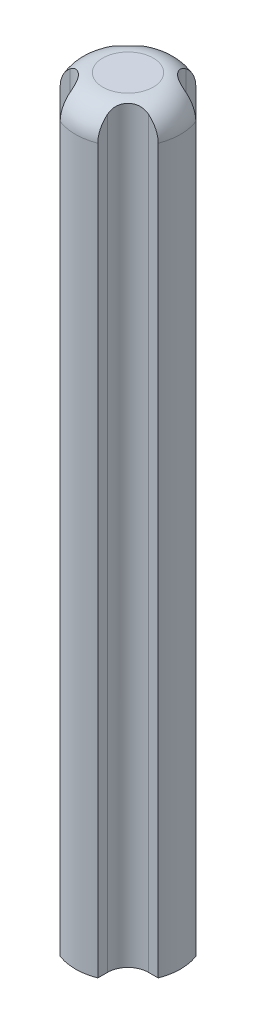
from build123d import *

# Parameters (mm, degrees)
SKETCH1_R           = 3.85
BOSS_EXTRUDE1_DEPTH = 55
FILLET1_R           = 2
SKETCH2_W           = 2.5
SKETCH2_H           = 2.5
CUT_EXTRUDE1_DEPTH  = 56.268842948
CIRPATTERN1_COUNT   = 4
FILLET2_R           = 1.5


with BuildPart() as part:
    # Sketch1 → Boss-Extrude1 (new body)
    with BuildSketch(Plane(origin=(0, 0, 0), x_dir=(1, 0, 0), z_dir=(0, 1, 0))):
        with Locations(Location((0, 0, 0), (0, 0, 270))):
            Circle(SKETCH1_R)
    extrude(amount=BOSS_EXTRUDE1_DEPTH)

    # Fillet1
    fillet1_edges = [part.edges().sort_by_distance(p)[0] for p in [
        (0, 55, -3.85),
    ]]
    fillet(fillet1_edges, radius=FILLET1_R)

    # Sketch2 → Cut-Extrude1 (cut, through all)
    with BuildSketch(Plane(origin=(0, 55, 0), x_dir=(1, 0, 0), z_dir=(0, 1, 0))):
        with Locations((2.628858223, -2.628858223)):
            Rectangle(SKETCH2_W, SKETCH2_H)
    cut_extrude1 = extrude(amount=-CUT_EXTRUDE1_DEPTH, mode=Mode.SUBTRACT)

    # CirPattern1: Cut-Extrude1 ×4 about axis
    cirpattern1_axis = Axis((0, 0, 0), (0, 1, 0))
    for i in range(1, CIRPATTERN1_COUNT):
        add(cut_extrude1.rotate(cirpattern1_axis, i * 360 / CIRPATTERN1_COUNT), mode=Mode.SUBTRACT)

    # Fillet2
    fillet2_edges = [part.edges().sort_by_distance(p)[0] for p in [
        (1.378858223, 27.498749218, -1.378858223),
        (-1.378858223, 27.498749218, -1.378858223),
        (-1.378858223, 27.498749218, 1.378858223),
        (1.378858223, 27.498749218, 1.378858223),
    ]]
    fillet(fillet2_edges, radius=FILLET2_R)


solid = part.part
